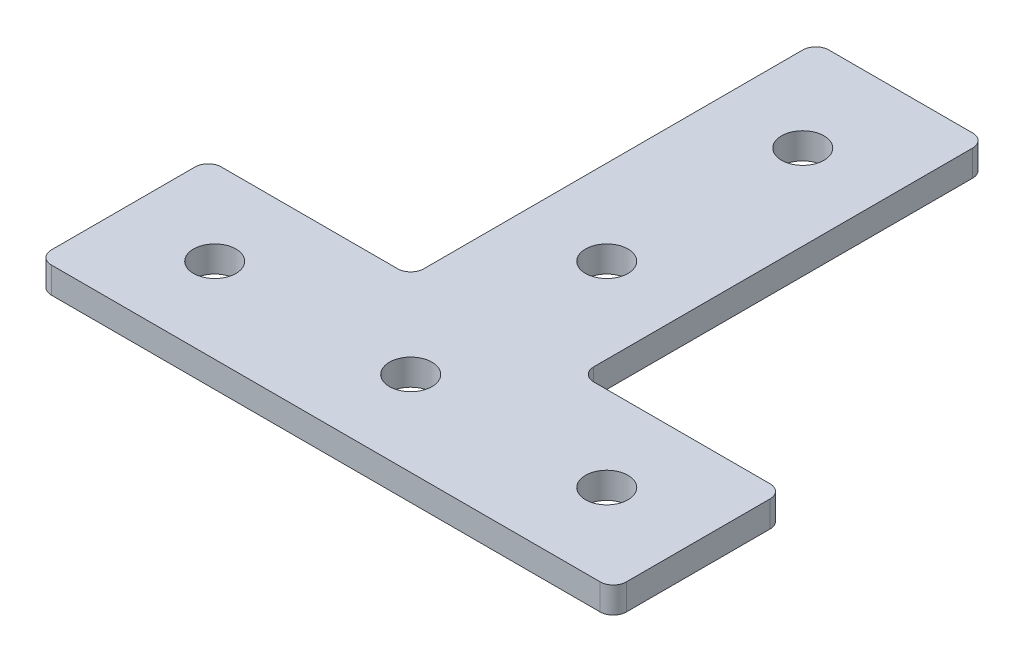
from build123d import *

# Parameters (mm, degrees)
BOSS_EXTRUDE1_DEPTH = 4
SKETCH3_R           = 3.25
CUT_EXTRUDE1_DEPTH  = 88.045964869
FILLET1_R           = 2


with BuildPart() as part:
    # Sketch1 → Boss-Extrude1 (new body)
    with BuildSketch(Plane(origin=(0, 0, 0), x_dir=(1, 0, 0), z_dir=(0, 1, 0))):
        Polygon((-44, 13), (-44, -13), (44, -13), (44, 13), (13, 13), (13, 75), (-13, 75), (-13, 13), align=None)
    extrude(amount=BOSS_EXTRUDE1_DEPTH)

    # Sketch3 → Cut-Extrude1 (cut, through all)
    with BuildSketch(Plane(origin=(0, 4, 0), x_dir=(1, 0, 0), z_dir=(0, 1, 0))):
        with Locations(Location((0, 0, 0), (0, 0, 270))):
            Circle(SKETCH3_R)
        with Locations(Location((30, 0, 0), (0, 0, 270))):
            Circle(SKETCH3_R)
        with Locations(Location((-30, 0, 0), (0, 0, 270))):
            Circle(SKETCH3_R)
        with Locations(Location((0, 60, 0), (0, 0, 270))):
            Circle(SKETCH3_R)
        with Locations(Location((0, 30, 0), (0, 0, 270))):
            Circle(SKETCH3_R)
    extrude(amount=-CUT_EXTRUDE1_DEPTH, mode=Mode.SUBTRACT)

    # Fillet1
    fillet1_edges = [part.edges().sort_by_distance(p)[0] for p in [
        (44, 2, 13),
        (-44, 2, 13),
        (-44, 2, -13),
        (-13, 2, -13),
        (-13, 2, -75),
        (13, 2, -75),
        (13, 2, -13),
        (44, 2, -13),
    ]]
    fillet(fillet1_edges, radius=FILLET1_R)


solid = part.part
